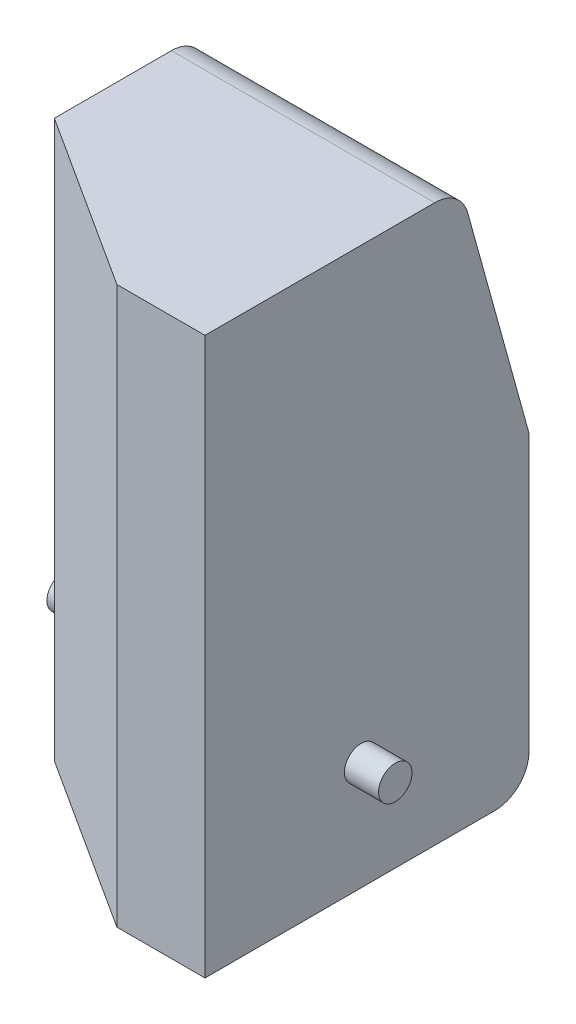
from build123d import *

# Parameters (mm, degrees)
BOSS_EXTRUDE1_DEPTH      = 163
CUT_EXTRUDE2_DEPTH       = 187.46178402
BOSS_EXTRUDE2_DEPTH      = 3
FILLET5_R                = 10
BOSS_EXTRUDE3_DEPTH      = 10
BOSS_EXTRUDE3_DEPTH_BACK = 87.12
SKETCH14_R               = 4.9
SKETCH15_R               = 10.5
CUT_EXTRUDE6_DEPTH       = 10


with BuildPart() as part:
    # Sketch2 → Boss-Extrude1 (new body)
    with BuildSketch(Plane(origin=(0, 0, 0), x_dir=(1, 0, 0), z_dir=(0, 1, 0))):
        Polygon((-38.56, 47.45), (38.56, 47.45), (38.56, -47.45), (12.75, -47.45), (-38.56, -14.45), align=None)
    extrude(amount=-BOSS_EXTRUDE1_DEPTH)

    # Sketch4 → Cut-Extrude2 (cut, through all)
    with BuildSketch(Plane(origin=(38.56, 0, 0), x_dir=(0, 0, -1), z_dir=(1, 0, 0))):
        Polygon((47.45, 0), (27.45, 0), (47.45, -72.29), align=None)
    extrude(amount=-CUT_EXTRUDE2_DEPTH, mode=Mode.SUBTRACT)

    # Sketch13 → Boss-Extrude2 (add)
    with BuildSketch(Plane(origin=(0, -30.389847605, -66.576077827), x_dir=(-1, 0, 0), z_dir=(0, -0.41525187691718835, -0.909706479429905))):
        Polygon((38.56, -46.058979838), (27.805, -22.388979838), (-1.995, -22.388979838), (-12.75, -46.058979838), align=None)
    extrude(amount=-BOSS_EXTRUDE2_DEPTH)

    # Fillet5
    fillet5_edges = [part.edges().sort_by_distance(p)[0] for p in [
        (0, -163, -47.45),
        (0, 0, -27.45),
        (-27.805, -50.134369817, -55.914452207),
        (1.995, -50.134369817, -55.914452207),
    ]]
    fillet(fillet5_edges, radius=FILLET5_R)

    # Sketch14 → Boss-Extrude3 (add, two sides: drawn at the far end of the back side and taken through both)
    with BuildSketch(Plane(origin=(38.56, 0, 0), x_dir=(0, 0, -1), z_dir=(1, 0, 0)).offset(-BOSS_EXTRUDE3_DEPTH_BACK)):
        with Locations((-1.72, -131.263122253)):
            Circle(SKETCH14_R)
    extrude(amount=BOSS_EXTRUDE3_DEPTH + BOSS_EXTRUDE3_DEPTH_BACK)

    # Sketch15 → Cut-Extrude6 (cut)
    with BuildSketch(Plane(origin=(0, 0, -47.45), x_dir=(-1, 0, 0), z_dir=(0, 0, -1))):
        with Locations((0, -129.37)):
            Circle(SKETCH15_R)
    extrude(amount=-CUT_EXTRUDE6_DEPTH, mode=Mode.SUBTRACT)


solid = part.part
